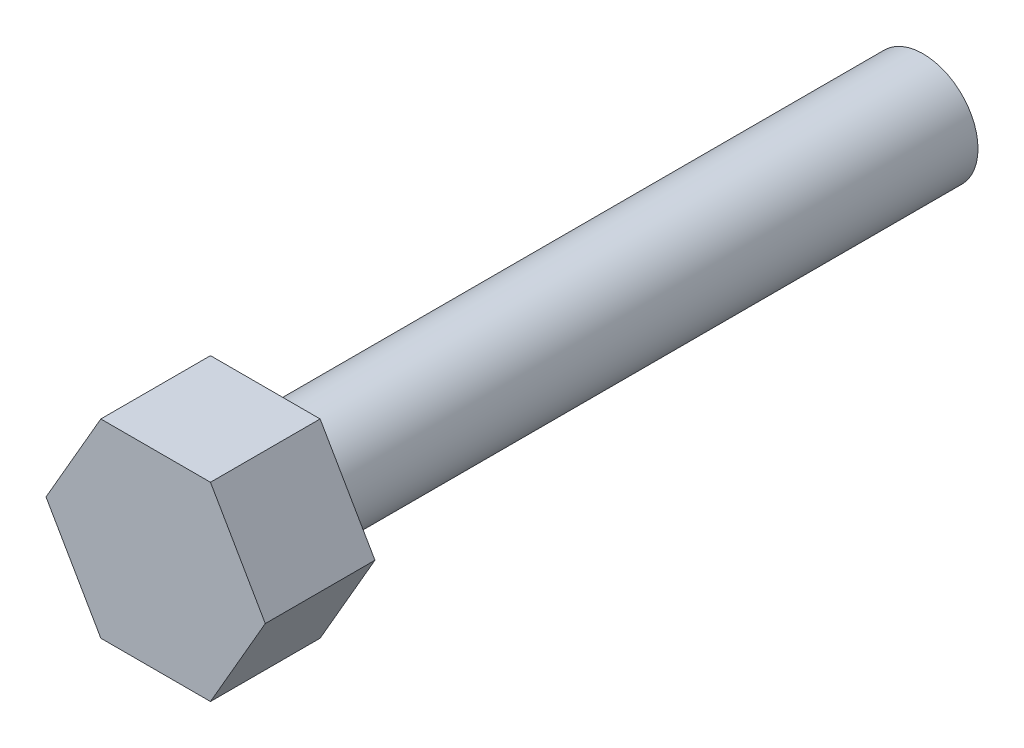
from build123d import *

# Parameters (mm, degrees)
IZIM1_R                     = 2.5
Y_KSEKLIK_EKSTR_ZYON1_DEPTH = 30
Y_KSEKLIK_EKSTR_ZYON2_DEPTH = 5


with BuildPart() as part:
    # Çizim1 → Yükseklik-Ekstrüzyon1 (new body)
    with BuildSketch(Plane.XY):
        Circle(IZIM1_R)
    extrude(amount=Y_KSEKLIK_EKSTR_ZYON1_DEPTH)

    # Çizim2 → Yükseklik-Ekstrüzyon2 (add)
    with BuildSketch(Plane.XY.offset(30)):
        Polygon((5, 0), (2.5, 4.330127019), (-2.5, 4.330127019), (-5, 0), (-2.5, -4.330127019), (2.5, -4.330127019), align=None)
    extrude(amount=Y_KSEKLIK_EKSTR_ZYON2_DEPTH)


solid = part.part
